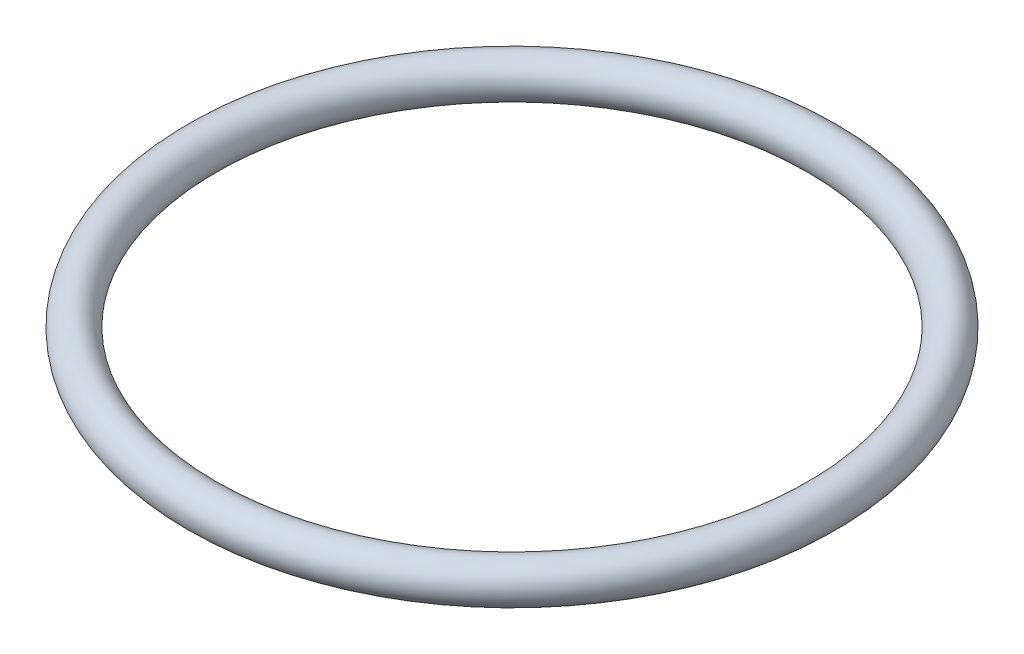
from build123d import *

# Parameters (mm, degrees)
SKETCH1_R = 1.5


with BuildPart() as part:
    # Sketch1 → Revolve1 (revolve)
    with BuildSketch(Plane.XY, mode=Mode.PRIVATE) as revolve1_sk:
        with Locations((-23.5, 0)):
            Circle(SKETCH1_R)
    revolve(revolve1_sk.sketch.rotate(Axis((0, 0, 0), (0, 1, 0)), 270), axis=Axis((0, 0, 0), (0, 1, 0)))


solid = part.part
